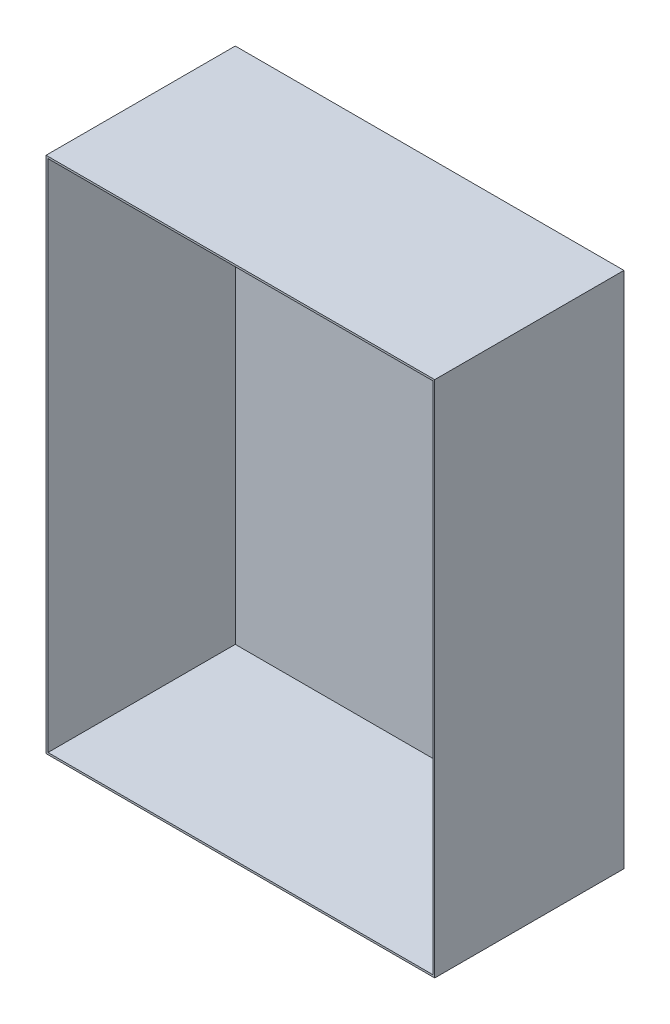
from build123d import *

# Parameters (mm, degrees)
SKETCH1_W           = 300
SKETCH1_H           = 400
BOSS_EXTRUDE1_DEPTH = 146.05
SHELL1_T            = -1.500000048


with BuildPart() as part:
    # Sketch1 → Boss-Extrude1 (new body)
    with BuildSketch(Plane.XY):
        Rectangle(SKETCH1_W, SKETCH1_H)
    extrude(amount=BOSS_EXTRUDE1_DEPTH)

    # Shell1
    shell1_openings = [part.faces().sort_by_distance(p)[0] for p in [
        (0, 0, 146.05),
    ]]
    offset(amount=SHELL1_T, openings=shell1_openings, kind=Kind.INTERSECTION)


solid = part.part
